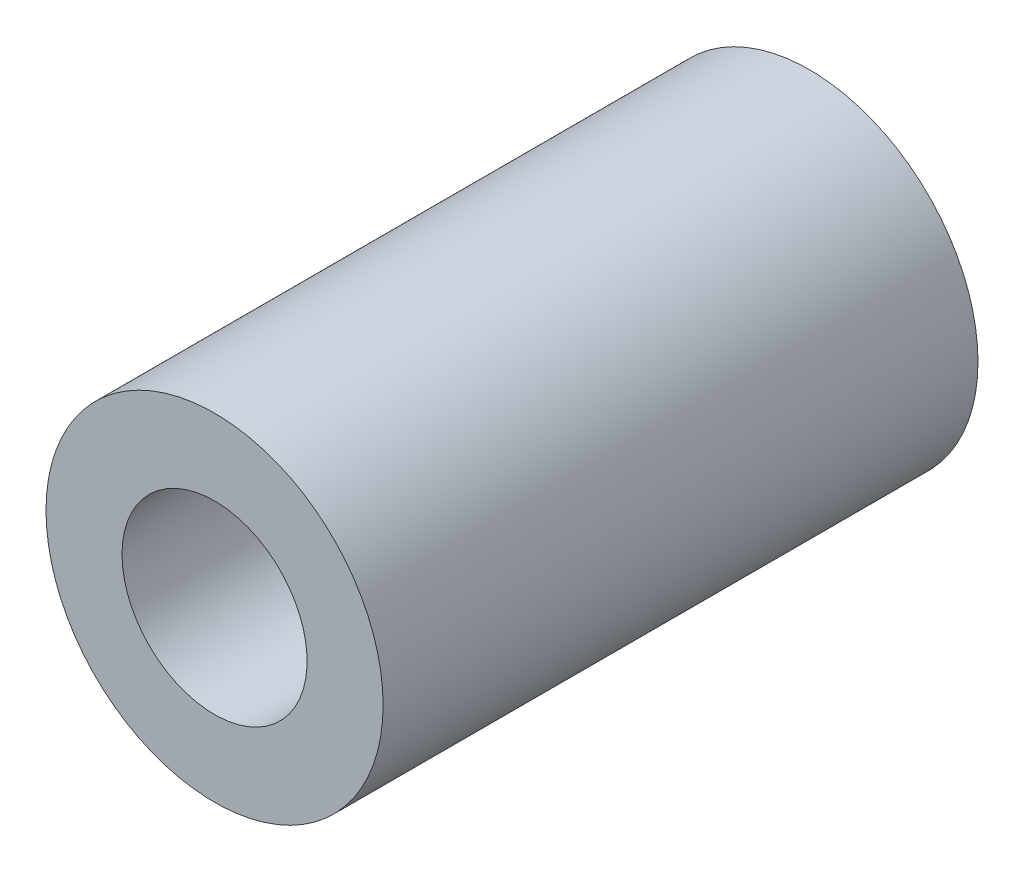
from build123d import *

# Parameters (mm, degrees)
SKETCH_1_R      = 12.75
SKETCH_1_R_2    = 7
EXTRUDE_1_DEPTH = 45


with BuildPart() as part:
    # 草图1 → 凸台-拉伸1 (new body)
    with BuildSketch(Plane.XY):
        with Locations(Location((0, 0, 0), (0, 0, 180))):
            Circle(SKETCH_1_R)
        with Locations(Location((0, 0, 0), (0, 0, 180))):
            Circle(SKETCH_1_R_2, mode=Mode.SUBTRACT)
    extrude(amount=EXTRUDE_1_DEPTH)


solid = part.part
